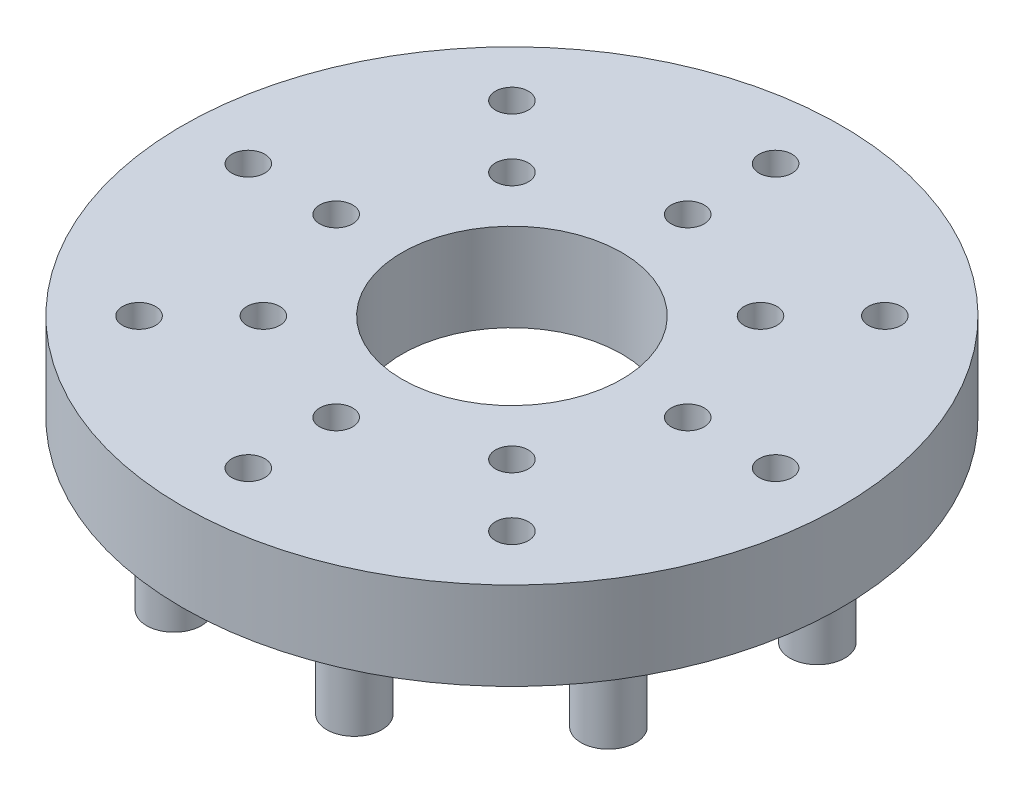
from build123d import *

# Parameters (mm, degrees)
SKETCH1_R           = 190.5
BOSS_EXTRUDE1_DEPTH = 50.8
SKETCH2_R           = 63.5
CUT_EXTRUDE1_DEPTH  = 275.155320941
SKETCH3_R           = 9.525
CUT_EXTRUDE2_DEPTH  = 42.926
SKETCH4_R           = 15.875
BOSS_EXTRUDE2_DEPTH = 50.8


with BuildPart() as part:
    # Sketch1 → Boss-Extrude1 (new body)
    with BuildSketch(Plane(origin=(0, 0, 0), x_dir=(1, 0, 0), z_dir=(0, 1, 0))):
        with Locations(Location((0, 0, 0), (0, 0, 270))):
            Circle(SKETCH1_R)
    extrude(amount=BOSS_EXTRUDE1_DEPTH)

    # Sketch2 → Cut-Extrude1 (cut, through all)
    with BuildSketch(Plane(origin=(0, 50.8, 0), x_dir=(1, 0, 0), z_dir=(0, 1, 0))):
        with Locations(Location((0, 0, 0), (0, 0, 270))):
            Circle(SKETCH2_R)
    extrude(amount=-CUT_EXTRUDE1_DEPTH, mode=Mode.SUBTRACT)

    # Sketch3 → Cut-Extrude2 (cut)
    with BuildSketch(Plane(origin=(0, 50.8, 0), x_dir=(1, 0, 0), z_dir=(0, 1, 0))):
        with Locations(Location((0, 101.6, 0), (0, 0, 270))):
            Circle(SKETCH3_R)
        with Locations(Location((71.842048969, 71.842048969, 0), (0, 0, 270))):
            Circle(SKETCH3_R)
        with Locations(Location((101.6, 0, 0), (0, 0, 270))):
            Circle(SKETCH3_R)
        with Locations(Location((71.842048969, -71.842048969, 0), (0, 0, 270))):
            Circle(SKETCH3_R)
        with Locations(Location((0, -101.6, 0), (0, 0, 270))):
            Circle(SKETCH3_R)
        with Locations(Location((-71.842048969, -71.842048969, 0), (0, 0, 270))):
            Circle(SKETCH3_R)
        with Locations(Location((-101.6, 0, 0), (0, 0, 270))):
            Circle(SKETCH3_R)
        with Locations(Location((-71.842048969, 71.842048969, 0), (0, 0, 270))):
            Circle(SKETCH3_R)
        with Locations(Location((0, 152.4, 0), (0, 0, 270))):
            Circle(SKETCH3_R)
        with Locations(Location((107.763073453, 107.763073453, 0), (0, 0, 270))):
            Circle(SKETCH3_R)
        with Locations(Location((152.4, 0, 0), (0, 0, 270))):
            Circle(SKETCH3_R)
        with Locations(Location((107.763073453, -107.763073453, 0), (0, 0, 270))):
            Circle(SKETCH3_R)
        with Locations(Location((0, -152.4, 0), (0, 0, 270))):
            Circle(SKETCH3_R)
        with Locations(Location((-107.763073453, -107.763073453, 0), (0, 0, 270))):
            Circle(SKETCH3_R)
        with Locations(Location((-152.4, 0, 0), (0, 0, 270))):
            Circle(SKETCH3_R)
        with Locations(Location((-107.763073453, 107.763073453, 0), (0, 0, 270))):
            Circle(SKETCH3_R)
    extrude(amount=-CUT_EXTRUDE2_DEPTH, mode=Mode.SUBTRACT)

    # Sketch4 → Boss-Extrude2 (add)
    with BuildSketch(Plane.XZ):
        with Locations(Location((0, -152.4, 0), (0, 0, 90))):
            Circle(SKETCH4_R)
        with Locations(Location((-97.960831716, -116.745173131, 0), (0, 0, 90))):
            Circle(SKETCH4_R)
        with Locations(Location((-150.084701559, -26.463982276, 0), (0, 0, 90))):
            Circle(SKETCH4_R)
        with Locations(Location((-131.982271537, 76.2, 0), (0, 0, 90))):
            Circle(SKETCH4_R)
        with Locations(Location((-52.123869843, 143.209155408, 0), (0, 0, 90))):
            Circle(SKETCH4_R)
        with Locations(Location((52.123869843, 143.209155408, 0), (0, 0, 90))):
            Circle(SKETCH4_R)
        with Locations(Location((131.982271537, 76.2, 0), (0, 0, 90))):
            Circle(SKETCH4_R)
        with Locations(Location((150.084701559, -26.463982276, 0), (0, 0, 90))):
            Circle(SKETCH4_R)
        with Locations(Location((97.960831716, -116.745173131, 0), (0, 0, 90))):
            Circle(SKETCH4_R)
    extrude(amount=BOSS_EXTRUDE2_DEPTH)


solid = part.part
